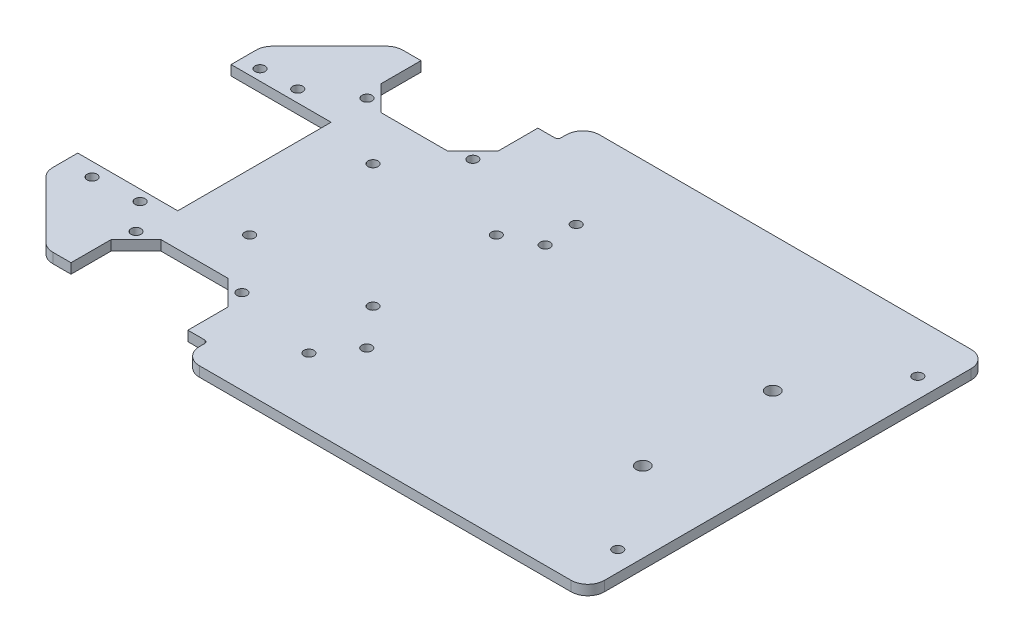
from build123d import *

# Parameters (mm, degrees)
BOSS_EXTRUDE1_DEPTH = 3
SKETCH4_W           = 30
SKETCH4_H           = 46
CUT_EXTRUDE1_DEPTH  = 3
FILLET1_R           = 5
FILLET2_R           = 1
SKETCH5_R           = 1.5
SKETCH5_R_2         = 2
CUT_EXTRUDE2_DEPTH  = 3


with BuildPart() as part:
    # Sketch1 → Boss-Extrude1 (new body)
    with BuildSketch(Plane(origin=(0, 0, 0), x_dir=(1, 0, 0), z_dir=(0, 1, 0))):
        Polygon((0, -32.526631134), (27.473368866, -60), (190, -60), (190, 60), (27.473368866, 60), (0, 32.526631134), align=None)
    extrude(amount=BOSS_EXTRUDE1_DEPTH)

    # Sketch4 → Cut-Extrude1 (cut)
    with BuildSketch(Plane(origin=(0, 0, 0), x_dir=(1, 0, 0), z_dir=(0, 1, 0))):
        Polygon((68.526631134, -60), (68.526631134, -52.5), (62.526631134, -52.5), (62.526631134, -40.526631134), (55, -33), (35, -33), (27.473368866, -40.526631134), (27.473368866, -52.5), (19.973368866, -52.5), (27.473368866, -60), align=None)
        Polygon((27.473368866, 60), (68.526631134, 60), (68.526631134, 52.5), (62.526631134, 52.5), (62.526631134, 40.526631134), (55, 33), (35, 33), (27.473368866, 40.526631134), (27.473368866, 52.5), (19.973368866, 52.5), align=None)
        with Locations((15, 0)):
            Rectangle(SKETCH4_W, SKETCH4_H)
    extrude(amount=CUT_EXTRUDE1_DEPTH, mode=Mode.SUBTRACT)

    # Fillet1
    fillet1_edges = [part.edges().sort_by_distance(p)[0] for p in [
        (190, 1.5, -60),
        (190, 1.5, 60),
        (0, 1.5, 32.526631134),
        (0, 1.5, -32.526631134),
        (68.526631134, 1.5, 60),
        (19.973368866, 1.5, 52.5),
        (19.973368866, 1.5, -52.5),
        (68.526631134, 1.5, -60),
    ]]
    fillet(fillet1_edges, radius=FILLET1_R)

    # Fillet2
    fillet2_edges = [part.edges().sort_by_distance(p)[0] for p in [
        (68.526631134, 1.5, 52.5),
        (68.526631134, 1.5, -52.5),
    ]]
    fillet(fillet2_edges, radius=FILLET2_R)

    # Sketch5 → Cut-Extrude2 (cut)
    with BuildSketch(Plane(origin=(0, 0, 0), x_dir=(1, 0, 0), z_dir=(0, 1, 0))):
        with Locations(Location((47.062554885, -18.5, 0), (0, 0, 270))):
            Circle(SKETCH5_R)
        with Locations(Location((84.062554885, -18.5, 0), (0, 0, 270))):
            Circle(SKETCH5_R)
        with Locations(Location((84.062554885, 18.5, 0), (0, 0, 270))):
            Circle(SKETCH5_R)
        with Locations(Location((47.062554885, 18.5, 0), (0, 0, 270))):
            Circle(SKETCH5_R)
        with Locations(Location((94, 23.219474586, 0), (0, 0, 270))):
            Circle(SKETCH5_R)
        with Locations(Location((93.305417602, 33.219474586, 0), (0, 0, 270))):
            Circle(SKETCH5_R)
        with Locations(Location((29.11536409, 34.641995223, 0), (0, 0, 270))):
            Circle(SKETCH5_R)
        with Locations(Location((60.88463591, 34.641995223, 0), (0, 0, 270))):
            Circle(SKETCH5_R)
        with Locations(Location((8.367356219, -27.085410895, 0), (0, 0, 270))):
            Circle(SKETCH5_R)
        with Locations(Location((16.379446424, 26.606355181, 0), (0, 0, 270))):
            Circle(SKETCH5_R)
        with Locations(Location((94, -30.308001182, 0), (0, 0, 270))):
            Circle(SKETCH5_R)
        with Locations(Location((86.659783805, -40.308001182, 0), (0, 0, 270))):
            Circle(SKETCH5_R)
        with Locations(Location((184, -45, 0), (0, 0, 270))):
            Circle(SKETCH5_R)
        with Locations(Location((184, 45, 0), (0, 0, 270))):
            Circle(SKETCH5_R)
        with Locations(Location((166, -19.5, 0), (0, 0, 270))):
            Circle(SKETCH5_R_2)
        with Locations(Location((166, 19.5, 0), (0, 0, 270))):
            Circle(SKETCH5_R_2)
        with Locations(Location((29.11536409, -34.641995223, 0), (0, 0, 270))):
            Circle(SKETCH5_R)
        with Locations(Location((60.88463591, -34.641995223, 0), (0, 0, 270))):
            Circle(SKETCH5_R)
        with Locations(Location((21.933678109, -26.25, 0), (0, 0, 270))):
            Circle(SKETCH5_R)
        with Locations(Location((5.439723212, 26.25, 0), (0, 0, 270))):
            Circle(SKETCH5_R)
    extrude(amount=CUT_EXTRUDE2_DEPTH, mode=Mode.SUBTRACT)


solid = part.part
